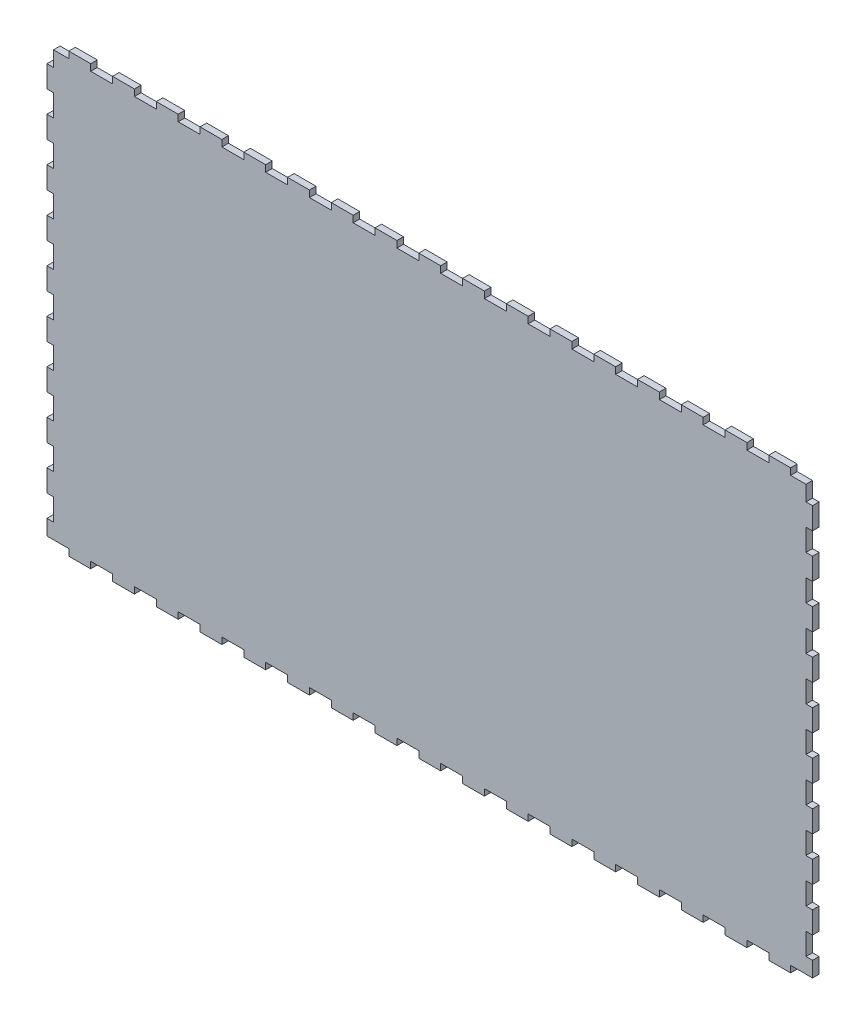
from build123d import *

# Parameters (mm, degrees)
SALIENTE_EXTRUIR1_DEPTH = 3


with BuildPart() as part:
    # Croquis1 → Saliente-Extruir1 (new body)
    with BuildSketch(Plane.XY):
        Polygon((-175, -97), (-165, -97), (-165, -100), (-155, -100), (-155, -97), (-145, -97), (-145, -100), (-135, -100), (-135, -97), (-125, -97), (-125, -100), (-115, -100), (-115, -97), (-105, -97), (-105, -100), (-95, -100), (-95, -97), (-85, -97), (-85, -100), (-75, -100), (-75, -97), (-65, -97), (-65, -100), (-55, -100), (-55, -97), (-45, -97), (-45, -100), (-35, -100), (-35, -97), (-25, -97), (-25, -100), (-15, -100), (-15, -97), (-5, -97), (-5, -100), (5, -100), (5, -97), (15, -97), (15, -100), (25, -100), (25, -97), (35, -97), (35, -100), (45, -100), (45, -97), (55, -97), (55, -100), (65, -100), (65, -97), (75, -97), (75, -100), (85, -100), (85, -97), (95, -97), (95, -100), (105, -100), (105, -97), (115, -97), (115, -100), (125, -100), (125, -97), (135, -97), (135, -100), (145, -100), (145, -97), (155, -97), (155, -100), (165, -100), (165, -97), (175, -97), (175, -90), (172, -90), (172, -80), (175, -80), (175, -70), (172, -70), (172, -60), (175, -60), (175, -50), (172, -50), (172, -40), (175, -40), (175, -30), (172, -30), (172, -20), (175, -20), (175, -10), (172, -10), (172, 0), (175, 0), (175, 10), (172, 10), (172, 20), (175, 20), (175, 30), (172, 30), (172, 40), (175, 40), (175, 50), (172, 50), (172, 60), (175, 60), (175, 70), (172, 70), (172, 80), (175, 80), (175, 90), (172, 90), (172, 97), (165, 97), (165, 100), (155, 100), (155, 97), (145, 97), (145, 100), (135, 100), (135, 97), (125, 97), (125, 100), (115, 100), (115, 97), (105, 97), (105, 100), (95, 100), (95, 97), (85, 97), (85, 100), (75, 100), (75, 97), (65, 97), (65, 100), (55, 100), (55, 97), (45, 97), (45, 100), (35, 100), (35, 97), (25, 97), (25, 100), (15, 100), (15, 97), (5, 97), (5, 100), (-5, 100), (-5, 97), (-15, 97), (-15, 100), (-25, 100), (-25, 97), (-35, 97), (-35, 100), (-45, 100), (-45, 97), (-55, 97), (-55, 100), (-65, 100), (-65, 97), (-75, 97), (-75, 100), (-85, 100), (-85, 97), (-95, 97), (-95, 100), (-105, 100), (-105, 97), (-115, 97), (-115, 100), (-125, 100), (-125, 97), (-135, 97), (-135, 100), (-145, 100), (-145, 97), (-155, 97), (-155, 100), (-165, 100), (-165, 97), (-172, 97), (-172, 90), (-175, 90), (-175, 80), (-172, 80), (-172, 70), (-175, 70), (-175, 60), (-172, 60), (-172, 50), (-175, 50), (-175, 40), (-172, 40), (-172, 30), (-175, 30), (-175, 20), (-172, 20), (-172, 10), (-175, 10), (-175, 0), (-172, 0), (-172, -10), (-175, -10), (-175, -20), (-172, -20), (-172, -30), (-175, -30), (-175, -40), (-172, -40), (-172, -50), (-175, -50), (-175, -60), (-172, -60), (-172, -70), (-175, -70), (-175, -80), (-172, -80), (-172, -90), (-175, -90), align=None)
    extrude(amount=SALIENTE_EXTRUIR1_DEPTH)


solid = part.part
